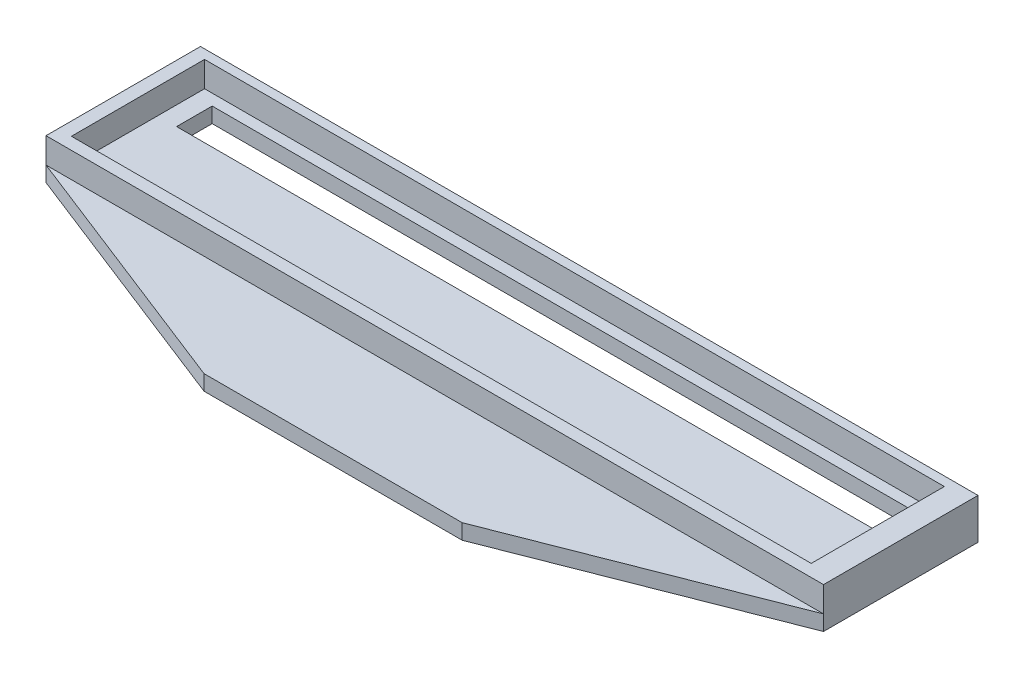
from build123d import *

# Parameters (mm, degrees)
CROQUIS1_W              = 76.5
CROQUIS1_H              = 15.2
SALIENTE_EXTRUIR1_DEPTH = 4
CROQUIS2_W              = 70.2
CROQUIS2_H              = 3.5
CORTAR_EXTRUIR1_DEPTH   = 4
CROQUIS3_W              = 72.792072964
CROQUIS3_H              = 13.1
CORTAR_EXTRUIR2_DEPTH   = 2.5
SALIENTE_EXTRUIR2_DEPTH = 1.5


with BuildPart() as part:
    # Croquis1 → Saliente-Extruir1 (new body)
    with BuildSketch(Plane(origin=(0, 0, 0), x_dir=(1, 0, 0), z_dir=(0, 1, 0))):
        Rectangle(CROQUIS1_W, CROQUIS1_H)
    extrude(amount=SALIENTE_EXTRUIR1_DEPTH)

    # Croquis2 → Cortar-Extruir1 (cut)
    with BuildSketch(Plane(origin=(0, 4, 0), x_dir=(1, 0, 0), z_dir=(0, 1, 0))):
        with Locations((0, 3.85)):
            Rectangle(CROQUIS2_W, CROQUIS2_H)
    extrude(amount=-CORTAR_EXTRUIR1_DEPTH, mode=Mode.SUBTRACT)

    # Croquis3 → Cortar-Extruir2 (cut)
    with BuildSketch(Plane(origin=(0, 4, 0), x_dir=(1, 0, 0), z_dir=(0, 1, 0))):
        with Locations((-0.553963518, 0.15)):
            Rectangle(CROQUIS3_W, CROQUIS3_H)
    extrude(amount=-CORTAR_EXTRUIR2_DEPTH, mode=Mode.SUBTRACT)

    # Croquis4 → Saliente-Extruir2 (add)
    with BuildSketch(Plane(origin=(0, 0, 0), x_dir=(1, 0, 0), z_dir=(0, 1, 0))):
        Polygon((-12.7, -17.6), (12.7, -17.6), (38.25, -7.6), (-38.25, -7.6), align=None)
    extrude(amount=SALIENTE_EXTRUIR2_DEPTH)


solid = part.part
